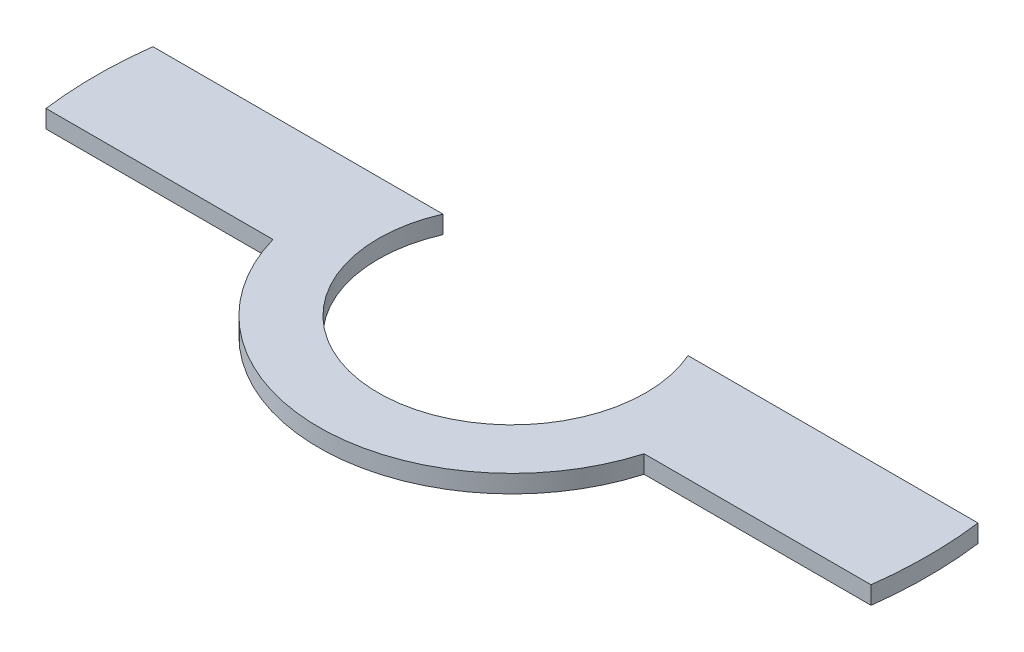
from build123d import *

# Parameters (mm, degrees)
SALIENTE_EXTRUIR1_DEPTH = 3


with BuildPart() as part:
    # Croquis1 → Saliente-Extruir1 (new body)
    with BuildSketch(Plane(origin=(0, 0, 0), x_dir=(1, 0, 0), z_dir=(0, 1, 0))):
        with BuildLine():
            Line((-31.228992939, -9), (-69.419017567, -9))
            ThreePointArc((-69.419017567, -9), (-70, 0), (-69.419017567, 9))
            Line((-69.419017567, 9), (-20.621590627, 9))
            ThreePointArc((-20.621590627, 9), (0, -22.5), (20.621590627, 9))
            Line((20.621590627, 9), (69.419017567, 9))
            ThreePointArc((69.419017567, 9), (70, 0), (69.419017567, -9))
            Line((69.419017567, -9), (31.228992939, -9))
            ThreePointArc((31.228992939, -9), (0, -32.5), (-31.228992939, -9))
        make_face()
    extrude(amount=SALIENTE_EXTRUIR1_DEPTH)


solid = part.part
